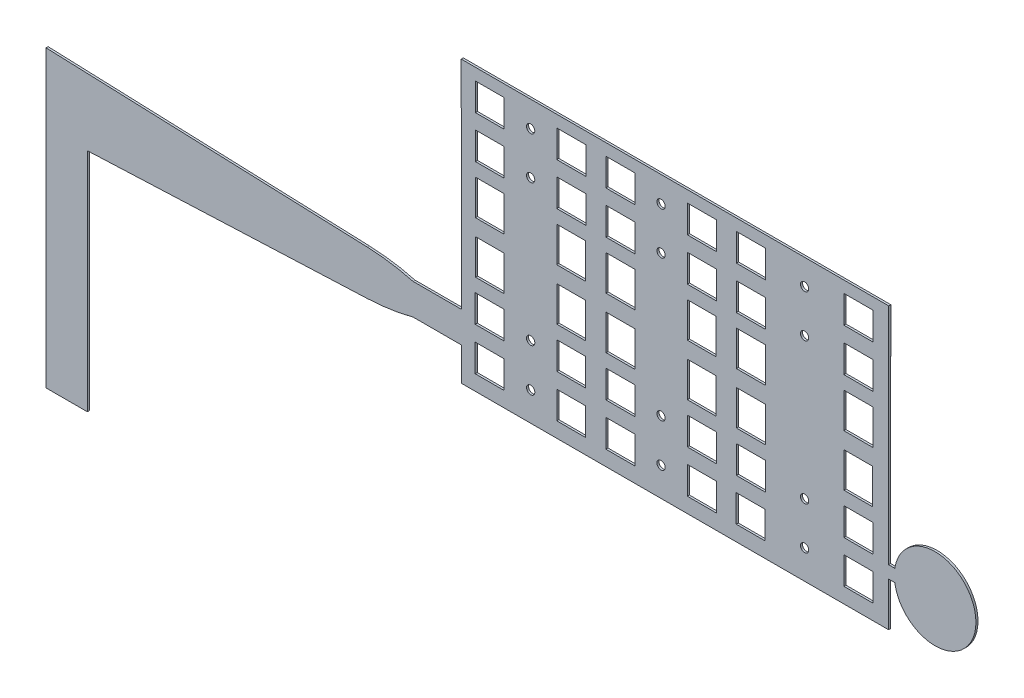
from build123d import *

# Parameters (mm, degrees)
MODEL_W                 = 7
MODEL_H                 = 6.630942294
MODEL_R                 = 1
MODEL_H_2               = 6.665988923
MODEL_H_3               = 6.616925392
MODEL_W_2               = 6.894659676
MODEL_H_4               = 8.495329649
MODEL_W_3               = 6.931437676
MODEL_H_5               = 8.494574831
MODEL_W_4               = 6.945883789
MODEL_H_6               = 6.634462872
MODEL_W_5               = 6.945884607
MODEL_H_7               = 6.629235122
MODEL_H_8               = 6.665988292
MODEL_W_6               = 6.98486848
MODEL_H_9               = 8.493402688
MODEL_W_7               = 6.919033543
MODEL_H_10              = 8.493333457
MODEL_W_8               = 6.925909472
MODEL_H_11              = 8.480055213
MODEL_H_12              = 6.679117497
MODEL_W_9               = 6.918536766
MODEL_H_13              = 8.489695878
MODEL_W_10              = 6.932983656
MODEL_H_14              = 8.48218631
MODEL_W_11              = 6.9390223
MODEL_H_15              = 8.492459023
MODEL_W_12              = 6.962590687
MODEL_H_16              = 8.493212208
MODEL_W_13              = 7.046520324
MODEL_H_17              = 6.629235123
MODEL_W_14              = 6.990015383
MODEL_H_18              = 6.675568647
MODEL_W_15              = 6.986834533
MODEL_H_19              = 8.480263561
MODEL_W_16              = 7.007978018
MODEL_W_17              = 6.977229442
MODEL_H_20              = 6.651040969
MODEL_W_18              = 7.031778298
MODEL_H_21              = 6.666902264
MODEL_W_19              = 6.962559352
MODEL_H_22              = 8.490997903
MODEL_W_20              = 6.989908154
MODEL_H_23              = 8.487666137
MODEL_W_21              = 6.994692138
MODEL_H_24              = 6.664080705
MODEL_W_22              = 7.005823033
MODEL_W_23              = 6.978695261
MODEL_H_25              = 6.648516769
SALIENTE_EXTRUIR1_DEPTH = 0.5


with BuildPart() as part:
    # Model → Saliente-Extruir1 (new body)
    with BuildSketch(Plane.XY):
        with BuildLine():
            Line((37.538312164, 4.987311607), (-40.154218399, 7.873567564))
            Line((-40.154218399, 7.873567564), (-40.154218399, -8.673577492))
            Line((-40.154218399, -8.673577492), (-40.154218399, -63.338132205))
            Line((-40.154218399, -63.338132205), (-30.154218399, -63.338132205))
            Line((-30.154218399, -63.338132205), (-30.154218399, -8.673577492))
            Line((-30.154218399, -8.673577492), (37.538263405, -5.787324088))
            add(Edge.make_bspline(
                [(48.594154861, -4.136124813), (48.367913722, -4.193288955), (47.915453693, -4.307611618), (47.23566531, -4.474625553), (46.553617247, -4.632174794), (45.868830038, -4.777481428), (45.181898967, -4.912437871), (44.263747793, -5.080377515), (43.112104197, -5.268009891), (42.032647568, -5.41213118), (41.10554392, -5.520018269), (40.409230851, -5.592467379), (39.634382447, -5.660288835), (38.936137709, -5.709903635), (38.237343308, -5.750702893), (37.771323367, -5.775115278), (37.538263405, -5.787324088)],
                knots=[0, 0, 0, 0, 0.062504393, 0.125002639, 0.187496914, 0.249996468, 0.312501528, 0.375006405, 0.500003401, 0.625000535, 0.666669894, 0.750008374, 0.812507807, 0.875002871, 0.937501105, 1, 1, 1, 1], degree=3))
            Line((48.594154861, -4.136124813), (60.258217894, -4.136124813))
            Line((60.258217894, -4.136124813), (60.258217894, -12.160684509))
            Line((60.258217894, -12.160684509), (163.540625482, -12.124027703))
            Line((163.540625482, -12.124027703), (163.54649977, -1.5))
            Line((163.54649977, -1.5), (165.04649977, -1.5))
            ThreePointArc((165.04649977, -1.5), (184.661209598, 0), (165.04649977, 1.5))
            Line((165.04649977, 1.5), (163.54649977, 1.5))
            Line((163.54649977, 1.5), (163.57348998, 55.705485689))
            Line((163.57348998, 55.705485689), (60.228633408, 55.705485689))
            Line((60.228633408, 55.705485689), (60.258217894, 3.336112806))
            Line((60.258217894, 3.336112806), (48.594163044, 3.336112806))
            add(Edge.make_bspline(
                [(48.594163044, 3.336112806), (48.367913722, 3.393279027), (47.915453693, 3.50760169), (47.23566531, 3.674615625), (46.553617247, 3.832164867), (45.868830038, 3.9774715), (45.181898967, 4.112427943), (44.263747793, 4.280367588), (43.112104197, 4.467999963), (42.032647568, 4.612121252), (41.10554392, 4.720008341), (40.409230851, 4.792457451), (39.634382447, 4.860278908), (38.936137709, 4.909893707), (38.237343308, 4.950692965), (37.771323367, 4.97510535), (37.538312164, 4.987311607)],
                knots=[0, 0, 0, 0, 0.062504393, 0.125002639, 0.187496914, 0.249996468, 0.312501528, 0.375006405, 0.500003401, 0.625000535, 0.666669894, 0.750008374, 0.812507807, 0.875002871, 0.937501105, 1, 1, 1, 1], degree=3))
        make_face()
        with Locations((67.103297518, -5.177437758)):
            Rectangle(MODEL_W, MODEL_H, mode=Mode.SUBTRACT)
        with Locations((77.015243359, -5.177437758)):
            Circle(MODEL_R, mode=Mode.SUBTRACT)
        with Locations((86.826552665, -5.177437758)):
            Rectangle(MODEL_W, MODEL_H, mode=Mode.SUBTRACT)
        with Locations((98.679508109, -5.156339417)):
            Rectangle(MODEL_W, MODEL_H_2, mode=Mode.SUBTRACT)
        with Locations((108.542264355, -5.177437758)):
            Circle(MODEL_R, mode=Mode.SUBTRACT)
        with Locations((118.387058487, -5.156339417)):
            Rectangle(MODEL_W, MODEL_H_2, mode=Mode.SUBTRACT)
        with Locations((130.20380789, -5.127457551)):
            Rectangle(MODEL_W, MODEL_H_3, mode=Mode.SUBTRACT)
        with Locations((143.244127713, -5.127457551)):
            Circle(MODEL_R, mode=Mode.SUBTRACT)
        with Locations((156.229046199, -5.127457551)):
            Rectangle(MODEL_W, MODEL_H_3, mode=Mode.SUBTRACT)
        with Locations((67.103297518, 5.177437758)):
            Rectangle(MODEL_W, MODEL_H, mode=Mode.SUBTRACT)
        with Locations((67.15596768, 16.006321005)):
            Rectangle(MODEL_W_2, MODEL_H_4, mode=Mode.SUBTRACT)
        with Locations((67.13757868, 28.458139139)):
            Rectangle(MODEL_W_3, MODEL_H_5, mode=Mode.SUBTRACT)
        with Locations((67.130355624, 39.270538007)):
            Rectangle(MODEL_W_4, MODEL_H_6, mode=Mode.SUBTRACT)
        with Locations((67.130355214, 49.519545861)):
            Rectangle(MODEL_W_5, MODEL_H_7, mode=Mode.SUBTRACT)
        with Locations((77.015243359, 5.177437758)):
            Circle(MODEL_R, mode=Mode.SUBTRACT)
        with Locations((86.826552665, 5.177437758)):
            Rectangle(MODEL_W, MODEL_H, mode=Mode.SUBTRACT)
        with Locations((98.679507588, 5.156339102)):
            Rectangle(MODEL_W, MODEL_H_8, mode=Mode.SUBTRACT)
        with Locations((108.542264355, 5.156339102)):
            Circle(MODEL_R, mode=Mode.SUBTRACT)
        with Locations((118.387058487, 5.156339102)):
            Rectangle(MODEL_W, MODEL_H_8, mode=Mode.SUBTRACT)
        with Locations((86.818986905, 15.993424774)):
            Rectangle(MODEL_W_6, MODEL_H_9, mode=Mode.SUBTRACT)
        with Locations((98.719990817, 15.984745022)):
            Rectangle(MODEL_W_7, MODEL_H_10, mode=Mode.SUBTRACT)
        with Locations((118.350013223, 15.969029564)):
            Rectangle(MODEL_W_8, MODEL_H_11, mode=Mode.SUBTRACT)
        with Locations((130.23009374, 5.127722451)):
            Rectangle(MODEL_W, MODEL_H_12, mode=Mode.SUBTRACT)
        with Locations((143.244127713, 5.12772245)):
            Circle(MODEL_R, mode=Mode.SUBTRACT)
        with Locations((156.243713309, 5.127722451)):
            Rectangle(MODEL_W, MODEL_H_12, mode=Mode.SUBTRACT)
        with Locations((130.270825357, 15.960572162)):
            Rectangle(MODEL_W_9, MODEL_H_13, mode=Mode.SUBTRACT)
        with Locations((156.210205137, 15.941309941)):
            Rectangle(MODEL_W_10, MODEL_H_14, mode=Mode.SUBTRACT)
        with Locations((86.796063815, 28.443128998)):
            Rectangle(MODEL_W_11, MODEL_H_15, mode=Mode.SUBTRACT)
        with Locations((98.698212245, 28.433896528)):
            Rectangle(MODEL_W_12, MODEL_H_16, mode=Mode.SUBTRACT)
        with Locations((77.015243359, 39.273151882)):
            Circle(MODEL_R, mode=Mode.SUBTRACT)
        with Locations((86.849812827, 39.273151881)):
            Rectangle(MODEL_W_13, MODEL_H_17, mode=Mode.SUBTRACT)
        with Locations((98.684499897, 39.247508377)):
            Rectangle(MODEL_W_14, MODEL_H_18, mode=Mode.SUBTRACT)
        with Locations((118.380475754, 28.416753005)):
            Rectangle(MODEL_W_15, MODEL_H_19, mode=Mode.SUBTRACT)
        with Locations((108.542264355, 39.273151882)):
            Circle(MODEL_R, mode=Mode.SUBTRACT)
        with Locations((118.391047496, 39.247508377)):
            Rectangle(MODEL_W_16, MODEL_H_18, mode=Mode.SUBTRACT)
        with Locations((77.01524295, 49.519545861)):
            Circle(MODEL_R, mode=Mode.SUBTRACT)
        with Locations((86.849812827, 49.519545861)):
            Rectangle(MODEL_W_13, MODEL_H_7, mode=Mode.SUBTRACT)
        with Locations((98.690892867, 49.532925527)):
            Rectangle(MODEL_W_17, MODEL_H_20, mode=Mode.SUBTRACT)
        with Locations((108.542264094, 49.519545861)):
            Circle(MODEL_R, mode=Mode.SUBTRACT)
        with Locations((118.402947636, 49.568540656)):
            Rectangle(MODEL_W_18, MODEL_H_21, mode=Mode.SUBTRACT)
        with Locations((130.248814064, 28.407849096)):
            Rectangle(MODEL_W_19, MODEL_H_22, mode=Mode.SUBTRACT)
        with Locations((156.238667386, 28.393069365)):
            Rectangle(MODEL_W_20, MODEL_H_23, mode=Mode.SUBTRACT)
        with Locations((130.232747671, 39.222746308)):
            Rectangle(MODEL_W_21, MODEL_H_24, mode=Mode.SUBTRACT)
        with Locations((143.242468972, 39.273151882)):
            Circle(MODEL_R, mode=Mode.SUBTRACT)
        with Locations((156.246624826, 39.222746308)):
            Rectangle(MODEL_W_22, MODEL_H_24, mode=Mode.SUBTRACT)
        with Locations((130.24074611, 49.562169467)):
            Rectangle(MODEL_W_23, MODEL_H_25, mode=Mode.SUBTRACT)
        with Locations((143.242468973, 49.569951436)):
            Circle(MODEL_R, mode=Mode.SUBTRACT)
        with Locations((156.246624826, 49.569951436)):
            Rectangle(MODEL_W_22, MODEL_H_24, mode=Mode.SUBTRACT)
    extrude(amount=SALIENTE_EXTRUIR1_DEPTH)


solid = part.part
